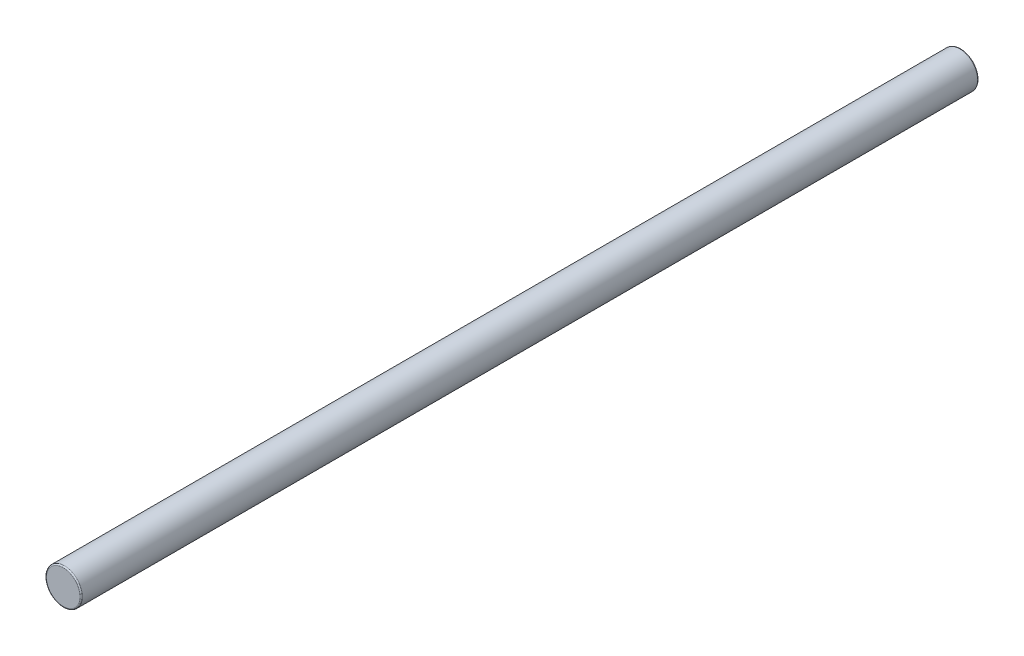
from build123d import *

# Parameters (mm, degrees)
SKETCH1_R           = 3
BOSS_EXTRUDE1_DEPTH = 150
FILLET1_R           = 0.2


with BuildPart() as part:
    # Sketch1 → Boss-Extrude1 (new body)
    with BuildSketch(Plane.XY):
        Circle(SKETCH1_R)
    extrude(amount=-BOSS_EXTRUDE1_DEPTH)

    # Fillet1
    fillet1_edges = [part.edges().sort_by_distance(p)[0] for p in [
        (-3, 0, 0),
        (-3, 0, -150),
    ]]
    fillet(fillet1_edges, radius=FILLET1_R)


solid = part.part
